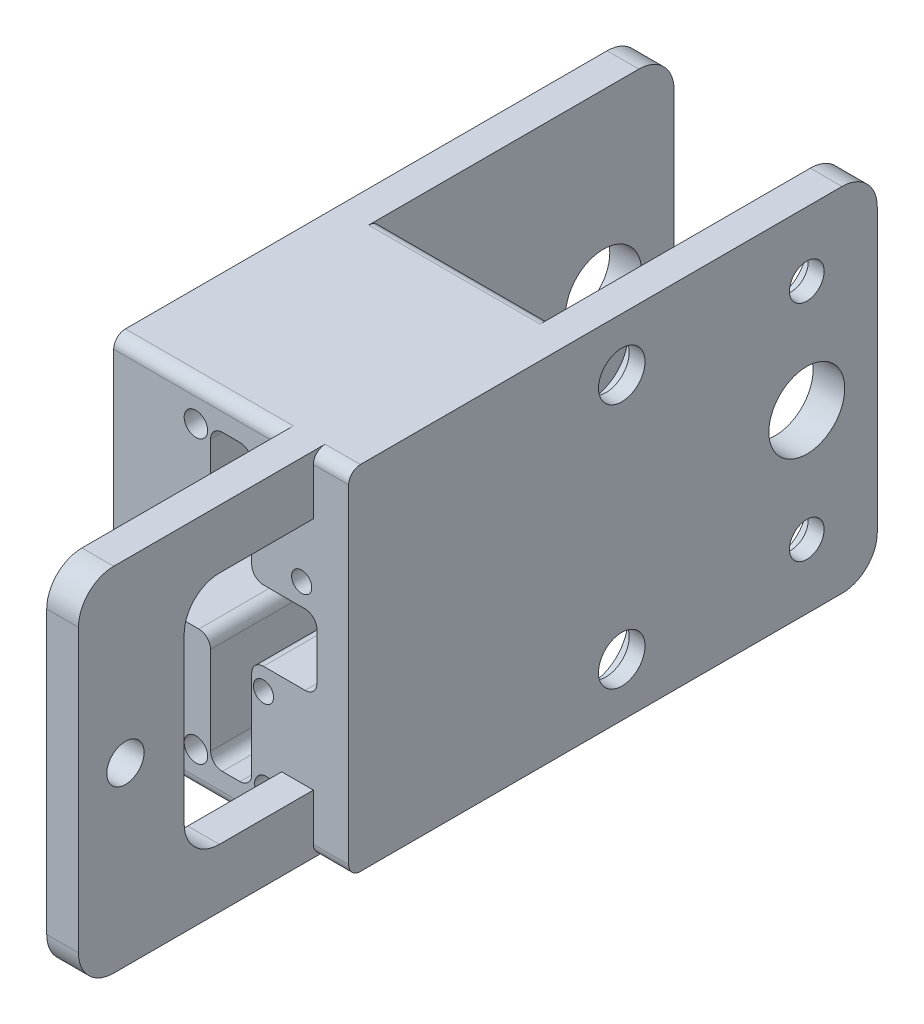
from build123d import *

# Parameters (mm, degrees)
SKETCH1_W             = 20
SKETCH1_H             = 20
BOSS_EXTRUDE3_DEPTH   = 30
CUT_EXTRUDE11_REACH   = 39.417
SKETCH10_R            = 0.86
FILLET4_R             = 1
SKETCH12_W            = 2.7
SKETCH12_H            = 30
BOSS_EXTRUDE13_DEPTH  = 20
CUT_EXTRUDE13_REACH   = 47.706
SKETCH14_R            = 1.59
SKETCH14_W            = 11
SKETCH14_H            = 20
FILLET6_R             = 3
SKETCH16_W            = 2.7
SKETCH16_H            = 30
BOSS_EXTRUDE14_DEPTH  = 25
CUT_EXTRUDE14_REACH   = 51.237
SKETCH17_R            = 3.23
FILLET11_R            = 3
FILLET11_OF_MIRROR1_R = 3
FILLET12_R            = 1
CUT_EXTRUDE15_REACH   = 52.99
SKETCH18_R            = 1
CUT_EXTRUDE16_REACH   = 51.237
SKETCH20_R            = 1.98
SKETCH20_R_2          = 1.475
SKETCH22_R            = 2.725
SKETCH22_R_2          = 3.23
CUT_EXTRUDE17_DEPTH   = 1.35


with BuildPart() as part:
    # Sketch1 → Boss-Extrude3 (new body)
    with BuildSketch(Plane(origin=(0, 0, 0), x_dir=(1, 0, 0), z_dir=(0, 1, 0))):
        Rectangle(SKETCH1_W, SKETCH1_H)
    extrude(amount=BOSS_EXTRUDE3_DEPTH)

    # Sketch10 → Cut-Extrude11 (cut, up to next)
    with BuildSketch(Plane(origin=(0, 0, -10), x_dir=(-1, 0, 0), z_dir=(0, 0, -1)), mode=Mode.PRIVATE) as cut_extrude11_sk1:
        with Locations((-6, 19.86)):
            Circle(SKETCH10_R)
    cut_extrude11_tool1 = extrude(cut_extrude11_sk1.sketch, amount=-CUT_EXTRUDE11_REACH, mode=Mode.PRIVATE) & part.part
    # Sketch10 → Cut-Extrude11 (cut, up to next)
    with BuildSketch(Plane(origin=(0, 0, -10), x_dir=(-1, 0, 0), z_dir=(0, 0, -1)), mode=Mode.PRIVATE) as cut_extrude11_sk2:
        with Locations((-2.75, 10.14)):
            Circle(SKETCH10_R)
    cut_extrude11_tool2 = extrude(cut_extrude11_sk2.sketch, amount=-CUT_EXTRUDE11_REACH, mode=Mode.PRIVATE) & part.part
    # Sketch10 → Cut-Extrude11 (cut, up to next)
    with BuildSketch(Plane(origin=(0, 0, -10), x_dir=(-1, 0, 0), z_dir=(0, 0, -1)), mode=Mode.PRIVATE) as cut_extrude11_sk3:
        Polygon((-1.75, 27.5), (1.75, 27.5), (1.75, 18), (7.3, 18), (7.3, 12), (1.75, 12), (1.75, 2.5), (-1.75, 2.5), (-1.75, 12), (-7.3, 12), (-7.3, 18), (-1.75, 18), align=None)
    cut_extrude11_tool3 = extrude(cut_extrude11_sk3.sketch, amount=-CUT_EXTRUDE11_REACH, mode=Mode.PRIVATE) & part.part
    add(cut_extrude11_tool1.solids().sort_by_distance((6, 19.86, -10))[0], mode=Mode.SUBTRACT)
    add(cut_extrude11_tool2.solids().sort_by_distance((2.75, 10.14, -10))[0], mode=Mode.SUBTRACT)
    add(cut_extrude11_tool3.solids().sort_by_distance((0, 15, -10))[0], mode=Mode.SUBTRACT)

    # Fillet4
    fillet4_edges = [part.edges().sort_by_distance(p)[0] for p in [
        (-1.75, 2.5, 0),
        (1.75, 2.5, 0),
        (1.75, 12, 0),
        (7.3, 12, 0),
        (7.3, 18, 0),
        (1.75, 18, 0),
        (1.75, 27.5, 0),
        (-1.75, 27.5, 0),
        (-1.75, 18, 0),
        (-7.3, 18, 0),
        (-7.3, 12, 0),
        (-1.75, 12, 0),
    ]]
    fillet(fillet4_edges, radius=FILLET4_R)

    # Sketch12 → Boss-Extrude13 (add)
    with BuildSketch(Plane.XY.offset(10)):
        with Locations((5.65, 15)):
            Rectangle(SKETCH12_W, SKETCH12_H)
    extrude(amount=BOSS_EXTRUDE13_DEPTH)

    # Sketch14 → Cut-Extrude13 (cut, up to next)
    with BuildSketch(Plane(origin=(7, 0, 0), x_dir=(0, 0, -1), z_dir=(1, 0, 0)), mode=Mode.PRIVATE) as cut_extrude13_sk1:
        with Locations((-26, 15)):
            Circle(SKETCH14_R)
    cut_extrude13_tool1 = extrude(cut_extrude13_sk1.sketch, amount=-CUT_EXTRUDE13_REACH, mode=Mode.PRIVATE) & part.part
    # Sketch14 → Cut-Extrude13 (cut, up to next)
    with BuildSketch(Plane(origin=(7, 0, 0), x_dir=(0, 0, -1), z_dir=(1, 0, 0)), mode=Mode.PRIVATE) as cut_extrude13_sk2:
        with Locations((-15.5, 15)):
            Rectangle(SKETCH14_W, SKETCH14_H)
    cut_extrude13_tool2 = extrude(cut_extrude13_sk2.sketch, amount=-CUT_EXTRUDE13_REACH, mode=Mode.PRIVATE) & part.part
    add(cut_extrude13_tool1.solids().sort_by_distance((7, 15, 26))[0], mode=Mode.SUBTRACT)
    add(cut_extrude13_tool2.solids().sort_by_distance((7, 15, 15.5))[0], mode=Mode.SUBTRACT)

    # Fillet6
    fillet6_edges = [part.edges().sort_by_distance(p)[0] for p in [
        (5.65, 0, 30),
        (5.65, 30, 30),
        (5.65, 5, 21),
        (5.65, 25, 21),
    ]]
    fillet(fillet6_edges, radius=FILLET6_R)

    # Sketch16 → Boss-Extrude14 (add)
    with BuildSketch(Plane(origin=(0, 0, -10), x_dir=(-1, 0, 0), z_dir=(0, 0, -1))):
        with Locations((8.65, 15)):
            Rectangle(SKETCH16_W, SKETCH16_H)
    boss_extrude14 = extrude(amount=BOSS_EXTRUDE14_DEPTH)

    # Sketch17 → Cut-Extrude14 (cut, up to next)
    with BuildSketch(Plane(origin=(-7.3, 0, 0), x_dir=(0, 0, -1), z_dir=(1, 0, 0)), mode=Mode.PRIVATE) as cut_extrude14_sk1:
        with Locations((29, 15)):
            Circle(SKETCH17_R)
    cut_extrude14_tool1 = extrude(cut_extrude14_sk1.sketch, amount=-CUT_EXTRUDE14_REACH, mode=Mode.PRIVATE) & part.part
    cut_extrude14 = cut_extrude14_tool1.solids().sort_by_distance((-7.3, 15, -29))[0]
    add(cut_extrude14, mode=Mode.SUBTRACT)

    # Fillet11
    fillet11_edges = [part.edges().sort_by_distance(p)[0] for p in [
        (-8.65, 30, -35),
        (-8.65, 0, -35),
    ]]
    fillet(fillet11_edges, radius=FILLET11_R)

    # Mirror1: Boss-Extrude14, Cut-Extrude14 across plane
    add(boss_extrude14.mirror(Plane(origin=(0, 0, 0), x_dir=(0, 0, 1), z_dir=(1, 0, 0))))
    add(cut_extrude14.mirror(Plane(origin=(0, 0, 0), x_dir=(0, 0, 1), z_dir=(1, 0, 0))), mode=Mode.SUBTRACT)

    # Fillet11 of Mirror1
    fillet11_of_mirror1_edges = [part.edges().sort_by_distance(p)[0] for p in [
        (8.65, 30, -35),
        (8.65, 0, -35),
    ]]
    fillet(fillet11_of_mirror1_edges, radius=FILLET11_OF_MIRROR1_R)

    # Fillet12
    fillet12_edges = [part.edges().sort_by_distance(p)[0] for p in [
        (8.5, 0, 10),
        (8.5, 30, 10),
        (0, 0, -10),
        (0, 30, -10),
        (-2.85, 30, 10),
        (-2.85, 0, 10),
    ]]
    fillet(fillet12_edges, radius=FILLET12_R)

    # Sketch18 → Cut-Extrude15 (cut, up to next)
    with BuildSketch(Plane(origin=(0, 0, -10), x_dir=(-1, 0, 0), z_dir=(0, 0, -1)), mode=Mode.PRIVATE) as cut_extrude15_sk1:
        with Locations((-3, 27)):
            Circle(SKETCH18_R)
    cut_extrude15_tool1 = extrude(cut_extrude15_sk1.sketch, amount=-CUT_EXTRUDE15_REACH, mode=Mode.PRIVATE) & part.part
    # Sketch18 → Cut-Extrude15 (cut, up to next)
    with BuildSketch(Plane(origin=(0, 0, -10), x_dir=(-1, 0, 0), z_dir=(0, 0, -1)), mode=Mode.PRIVATE) as cut_extrude15_sk2:
        with Locations((3, 3)):
            Circle(SKETCH18_R)
    cut_extrude15_tool2 = extrude(cut_extrude15_sk2.sketch, amount=-CUT_EXTRUDE15_REACH, mode=Mode.PRIVATE) & part.part
    cut_extrude15_1 = cut_extrude15_tool1.solids().sort_by_distance((3, 27, -10))[0]
    add(cut_extrude15_1, mode=Mode.SUBTRACT)
    cut_extrude15_2 = cut_extrude15_tool2.solids().sort_by_distance((-3, 3, -10))[0]
    add(cut_extrude15_2, mode=Mode.SUBTRACT)
    cut_extrude15 = cut_extrude15_1 + cut_extrude15_2  # Cut-Extrude15 as one shape, for the pattern or mirror that repeats it

    # Mirror2: Cut-Extrude15 across plane
    add(cut_extrude15.mirror(Plane(origin=(0, 0, 0), x_dir=(0, 0, 1), z_dir=(1, 0, 0))), mode=Mode.SUBTRACT)

    # Sketch20 → Cut-Extrude16 (cut, up to next)
    with BuildSketch(Plane.ZY.offset(7.3), mode=Mode.PRIVATE) as cut_extrude16_sk1:
        with Locations((-13.25, 25.48)):
            Circle(SKETCH20_R)
    cut_extrude16_tool1 = extrude(cut_extrude16_sk1.sketch, amount=-CUT_EXTRUDE16_REACH, mode=Mode.PRIVATE) & part.part
    # Sketch20 → Cut-Extrude16 (cut, up to next)
    with BuildSketch(Plane.ZY.offset(7.3), mode=Mode.PRIVATE) as cut_extrude16_sk2:
        with Locations((-13.25, 4.52)):
            Circle(SKETCH20_R)
    cut_extrude16_tool2 = extrude(cut_extrude16_sk2.sketch, amount=-CUT_EXTRUDE16_REACH, mode=Mode.PRIVATE) & part.part
    # Sketch20 → Cut-Extrude16 (cut, up to next)
    with BuildSketch(Plane.ZY.offset(7.3), mode=Mode.PRIVATE) as cut_extrude16_sk3:
        with Locations((-29, 5.48)):
            Circle(SKETCH20_R_2)
    cut_extrude16_tool3 = extrude(cut_extrude16_sk3.sketch, amount=-CUT_EXTRUDE16_REACH, mode=Mode.PRIVATE) & part.part
    # Sketch20 → Cut-Extrude16 (cut, up to next)
    with BuildSketch(Plane.ZY.offset(7.3), mode=Mode.PRIVATE) as cut_extrude16_sk4:
        with Locations((-29, 24.52)):
            Circle(SKETCH20_R_2)
    cut_extrude16_tool4 = extrude(cut_extrude16_sk4.sketch, amount=-CUT_EXTRUDE16_REACH, mode=Mode.PRIVATE) & part.part
    add(cut_extrude16_tool1.solids().sort_by_distance((-7.3, 25.48, -13.25))[0], mode=Mode.SUBTRACT)
    add(cut_extrude16_tool2.solids().sort_by_distance((-7.3, 4.52, -13.25))[0], mode=Mode.SUBTRACT)
    add(cut_extrude16_tool3.solids().sort_by_distance((-7.3, 5.48, -29))[0], mode=Mode.SUBTRACT)
    add(cut_extrude16_tool4.solids().sort_by_distance((-7.3, 24.52, -29))[0], mode=Mode.SUBTRACT)

    # Sketch22 → Cut-Extrude17 (cut)
    with BuildSketch(Plane.ZY.offset(-7.3)):
        with Locations(Location((-29, 24.52, 0), (0, 0, 270))):
            Circle(SKETCH22_R)
        with Locations(Location((-13.25, 25.48, 0), (0, 0, 270))):
            Circle(SKETCH22_R_2)
        with Locations(Location((-13.25, 4.52, 0), (0, 0, 270))):
            Circle(SKETCH22_R_2)
        with Locations(Location((-29, 5.48, 0), (0, 0, 270))):
            Circle(SKETCH22_R)
    extrude(amount=-CUT_EXTRUDE17_DEPTH, mode=Mode.SUBTRACT)


solid = part.part
